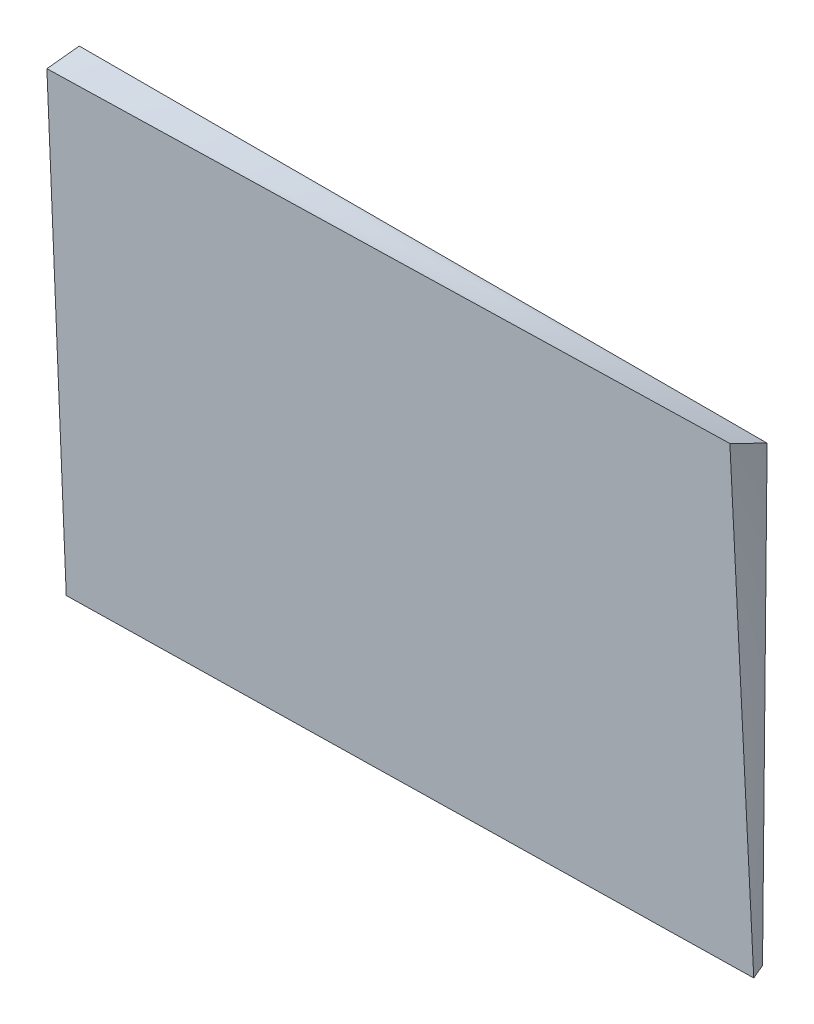
from build123d import *


with BuildPart() as part:
    # Skizze1 → Ausformung2 section 0
    with BuildSketch(Plane.XY):
        with BuildLine():
            Line((-14.999831078, 9.999747037), (-14.999831078, -10.100252963))
            Line((-14.999831078, -10.100252963), (14.899493233, -9.89924111))
            Line((14.899493233, -9.89924111), (15.100168922, 9.999747037))
            Line((15.100168922, 9.999747037), (-14.999831078, 9.999747037))
        make_face()
    # Skizze2 → Ausformung2 section 1
    with BuildSketch(Plane(origin=(0, -0.017452406437280042, 0.9998476951563912), x_dir=(-1, 0, 0), z_dir=(0, 0.017452406437280046, -0.9998476951563913))):
        with BuildLine():
            Line((15.248840604, 9.619476802), (14.748576577, -10.274234162))
            Line((14.748576577, -10.274234162), (-15.346257786, -9.716610047))
            Line((-15.346257786, -9.716610047), (-14.651159396, 10.371367408))
            Line((-14.651159396, 10.371367408), (15.248840604, 9.619476802))
        make_face()
    loft()


solid = part.part
